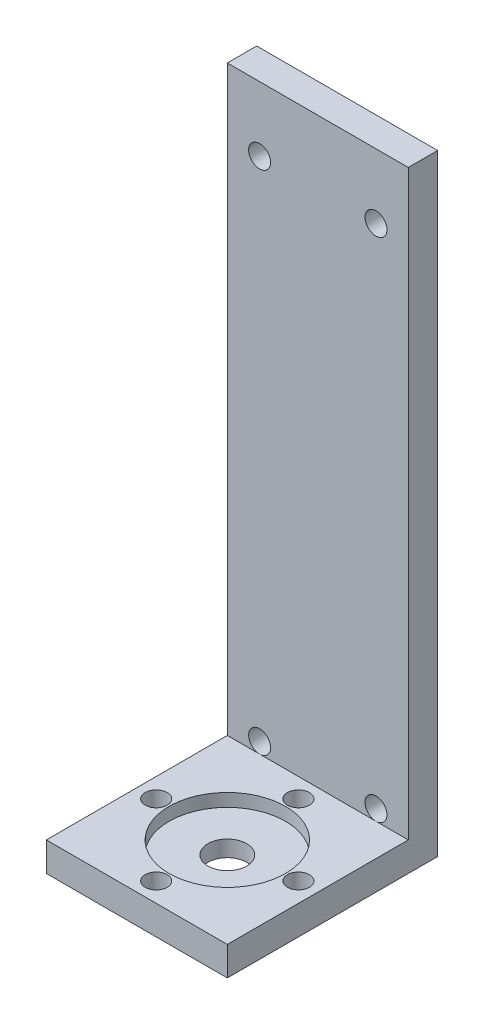
from build123d import *

# Parameters (mm, degrees)
SKETCH1_W           = 28
SKETCH1_H           = 28
SKETCH1_R           = 3
SKETCH1_R_2         = 1.7
BOSS_EXTRUDE1_DEPTH = 4.5
SKETCH2_W           = 28
SKETCH2_H           = 94.6
BOSS_EXTRUDE2_DEPTH = 4.545037206
SKETCH3_R           = 1.7
CUT_EXTRUDE1_DEPTH  = 103.553205703
SKETCH5_R           = 9
CUT_EXTRUDE2_DEPTH  = 2


with BuildPart() as part:
    # Sketch1 → Boss-Extrude1 (new body)
    with BuildSketch(Plane(origin=(0, 0, 0), x_dir=(1, 0, 0), z_dir=(0, 1, 0))):
        with Locations((14, 14)):
            Rectangle(SKETCH1_W, SKETCH1_H)
        with Locations(Location((14, 14, 0), (0, 0, 270))):
            Circle(SKETCH1_R, mode=Mode.SUBTRACT)
        with Locations(Location((14, 25, 0), (0, 0, 270))):
            Circle(SKETCH1_R_2, mode=Mode.SUBTRACT)
        with Locations(Location((25, 14, 0), (0, 0, 270))):
            Circle(SKETCH1_R_2, mode=Mode.SUBTRACT)
        with Locations(Location((14, 3, 0), (0, 0, 270))):
            Circle(SKETCH1_R_2, mode=Mode.SUBTRACT)
        with Locations(Location((3, 14, 0), (0, 0, 270))):
            Circle(SKETCH1_R_2, mode=Mode.SUBTRACT)
    extrude(amount=BOSS_EXTRUDE1_DEPTH)

    # Sketch2 → Boss-Extrude2 (add)
    with BuildSketch(Plane(origin=(0, 0, -28), x_dir=(-1, 0, 0), z_dir=(0, 0, -1))):
        with Locations((-14, 47.3)):
            Rectangle(SKETCH2_W, SKETCH2_H)
    extrude(amount=BOSS_EXTRUDE2_DEPTH)

    # Sketch3 → Cut-Extrude1 (cut, through all)
    with BuildSketch(Plane.XY.offset(-28)):
        with Locations((5, 6.2)):
            Circle(SKETCH3_R)
        with Locations((5, 84.6)):
            Circle(SKETCH3_R)
        with Locations(Location((23, 6.2, 0), (0, 0, 270))):
            Circle(SKETCH3_R)
        with Locations(Location((23, 84.6, 0), (0, 0, 180))):
            Circle(SKETCH3_R)
    extrude(amount=-CUT_EXTRUDE1_DEPTH, mode=Mode.SUBTRACT)

    # Sketch5 → Cut-Extrude2 (cut)
    with BuildSketch(Plane(origin=(0, 4.5, 0), x_dir=(1, 0, 0), z_dir=(0, 1, 0))):
        with Locations(Location((14, 14, 0), (0, 0, 270))):
            Circle(SKETCH5_R)
    extrude(amount=-CUT_EXTRUDE2_DEPTH, mode=Mode.SUBTRACT)


solid = part.part
